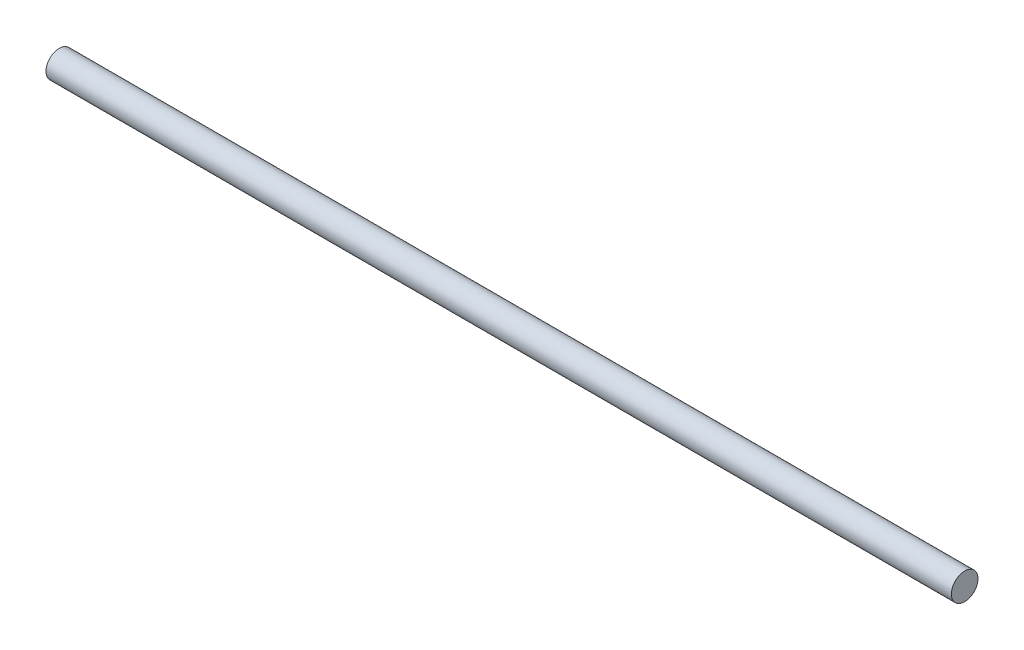
from build123d import *

# Parameters (mm, degrees)
SKETCH1_R           = 5
BOSS_EXTRUDE1_DEPTH = 170


with BuildPart() as part:
    # Sketch1 → Boss-Extrude1 (new, symmetric)
    with BuildSketch(Plane(origin=(0, 0, 0), x_dir=(0, 0, -1), z_dir=(1, 0, 0))):
        Circle(SKETCH1_R)
    extrude(amount=BOSS_EXTRUDE1_DEPTH, both=True)


solid = part.part
